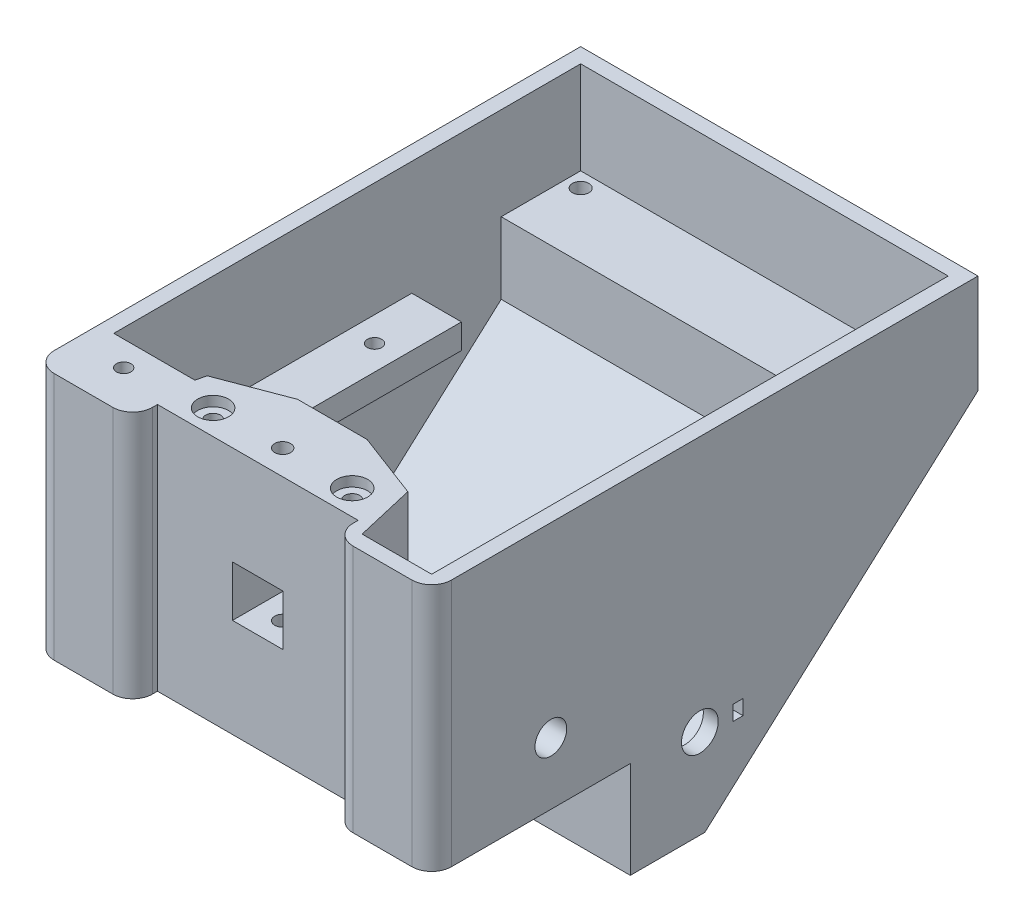
from build123d import *

# Parameters (mm, degrees)
BOSS_EXTRUDE1_DEPTH = 80
SHELL1_T            = -3
SKETCH3_W           = 46
SKETCH3_H           = 47
BOSS_EXTRUDE2_DEPTH = 17
SKETCH4_W           = 10.2
SKETCH4_H           = 10.2
CUT_EXTRUDE1_DEPTH  = 20
SKETCH6_W           = 15
SKETCH6_H           = 12.8
CUT_EXTRUDE2_DEPTH  = 3
SKETCH7_W           = 40.4
SKETCH7_H           = 50
CUT_EXTRUDE3_DEPTH  = 5
FILLET1_R           = 4
CUT_EXTRUDE7_DEPTH  = 47
SKETCH13_R          = 1.5
CUT_EXTRUDE8_DEPTH  = 25
SKETCH14_R          = 3.1
CUT_EXTRUDE9_DEPTH  = 2
SKETCH17_W          = 45
SKETCH17_H          = 5
BOSS_EXTRUDE5_DEPTH = 74
CUT_EXTRUDE10_REACH = 126.093
SKETCH18_W          = 54
SKETCH18_H          = 45
CUT_EXTRUDE11_REACH = 126.093
SKETCH19_R          = 1.45
BOSS_EXTRUDE6_DEPTH = 47
SKETCH22_R          = 1.45
CUT_EXTRUDE12_DEPTH = 135.415364765
CUT_EXTRUDE13_REACH = 126.857
SKETCH24_R          = 3.7
SKETCH24_W          = 2
SKETCH24_H          = 3
BOSS_EXTRUDE7_DEPTH = 74
SKETCH27_R          = 1.65
CUT_EXTRUDE14_DEPTH = 10
CUT_EXTRUDE15_START = -3
CUT_EXTRUDE15_DEPTH = 32
CUT_EXTRUDE16_DEPTH = 30
BOSS_EXTRUDE8_DEPTH = 20
SKETCH31_R          = 1.5
CUT_EXTRUDE17_DEPTH = 123.649786567
CUT_EXTRUDE18_DEPTH = 15
CUT_EXTRUDE19_REACH = 126.093
SKETCH33_W          = 10
SKETCH33_H          = 5
SKETCH34_R          = 1.6
CUT_EXTRUDE20_DEPTH = 135.415364765
CUT_EXTRUDE22_DEPTH = 14
CUT_EXTRUDE23_REACH = 126.857
SKETCH37_R          = 3.2
SKETCH38_W          = 10
SKETCH38_H          = 18.980735551
SKETCH38_R          = 3.2
BOSS_EXTRUDE9_DEPTH = 3
CUT_EXTRUDE24_REACH = 124.956
SKETCH40_R          = 3.7
SKETCH40_W          = 2
SKETCH40_H          = 3


with BuildPart() as part:
    # Sketch2 → Boss-Extrude1 (new body)
    with BuildSketch(Plane(origin=(0, 0, 0), x_dir=(0, 0, -1), z_dir=(1, 0, 0))):
        Polygon((-27.320490368, 20.998248687), (-27.320490368, -29.001751313), (12.679509632, -29.001751313), (12.679509632, -48.511383538), (27.679509632, -48.511383538), (82.679509632, 0.998248687), (82.679509632, 20.998248687), align=None)
    extrude(amount=BOSS_EXTRUDE1_DEPTH)

    # Shell1
    shell1_openings = [part.faces().sort_by_distance(p)[0] for p in [
        (40, 20.998248687, -27.679509632),
    ]]
    offset(amount=SHELL1_T, openings=shell1_openings, kind=Kind.INTERSECTION)

    # Sketch3 → Boss-Extrude2 (add)
    with BuildSketch(Plane(origin=(0, 0, 24.320490368), x_dir=(-1, 0, 0), z_dir=(0, 0, -1))):
        with Locations((-40, -2.501751313)):
            Rectangle(SKETCH3_W, SKETCH3_H)
    extrude(amount=BOSS_EXTRUDE2_DEPTH)

    # Sketch4 → Cut-Extrude1 (cut)
    with BuildSketch(Plane.XY.offset(27.320490368)):
        with Locations((40, -4.001751313)):
            Rectangle(SKETCH4_W, SKETCH4_H)
    extrude(amount=-CUT_EXTRUDE1_DEPTH, mode=Mode.SUBTRACT)

    # Sketch6 → Cut-Extrude2 (cut)
    with BuildSketch(Plane.XZ.offset(29.001751313)):
        with Locations((40, 0.920490368)):
            Rectangle(SKETCH6_W, SKETCH6_H)
    extrude(amount=-CUT_EXTRUDE2_DEPTH, mode=Mode.SUBTRACT)

    # Sketch7 → Cut-Extrude3 (cut)
    with BuildSketch(Plane.XY.offset(27.320490368)):
        with Locations((40, -4.001751313)):
            Rectangle(SKETCH7_W, SKETCH7_H)
    extrude(amount=-CUT_EXTRUDE3_DEPTH, mode=Mode.SUBTRACT)

    # Fillet1
    fillet1_edges = [part.edges().sort_by_distance(p)[0] for p in [
        (80, -4.001751313, 27.320490368),
        (19.8, -4.001751313, 27.320490368),
        (0, -4.001751313, 27.320490368),
        (60.2, -4.001751313, 27.320490368),
    ]]
    fillet(fillet1_edges, radius=FILLET1_R)

    # Sketch12 → Cut-Extrude7 (cut)
    with BuildSketch(Plane(origin=(0, 20.998248687, 0), x_dir=(1, 0, 0), z_dir=(0, 1, 0))):
        Polygon((33, -7.320490368), (19.8, -12.320490368), (17, -24.320490368), (17, -7.320490368), align=None)
        Polygon((47, -7.320490368), (63, -7.320490368), (63, -24.320490368), (60.2, -12.320490368), align=None)
    extrude(amount=-CUT_EXTRUDE7_DEPTH, mode=Mode.SUBTRACT)

    # Sketch13 → Cut-Extrude8 (cut)
    with BuildSketch(Plane(origin=(0, 20.998248687, 0), x_dir=(1, 0, 0), z_dir=(0, 1, 0))):
        with Locations(Location((26, -17.320490368, 0), (0, 0, 270))):
            Circle(SKETCH13_R)
        with Locations(Location((54, -17.320490368, 0), (0, 0, 270))):
            Circle(SKETCH13_R)
    extrude(amount=-CUT_EXTRUDE8_DEPTH, mode=Mode.SUBTRACT)

    # Sketch14 → Cut-Extrude9 (cut)
    with BuildSketch(Plane(origin=(0, 20.998248687, 0), x_dir=(1, 0, 0), z_dir=(0, 1, 0))):
        with Locations(Location((26, -17.320490368, 0), (0, 0, 270))):
            Circle(SKETCH14_R)
        with Locations(Location((54, -17.320490368, 0), (0, 0, 270))):
            Circle(SKETCH14_R)
    extrude(amount=-CUT_EXTRUDE9_DEPTH, mode=Mode.SUBTRACT)

    # Sketch17 → Boss-Extrude5 (add)
    with BuildSketch(Plane.ZY.offset(-77)):
        with Locations((-23.179509632, -4.501751313)):
            Rectangle(SKETCH17_W, SKETCH17_H)
    extrude(amount=BOSS_EXTRUDE5_DEPTH)

    # Sketch18 → Cut-Extrude10 (cut, up to next)
    with BuildSketch(Plane(origin=(0, -2.001751313, 0), x_dir=(1, 0, 0), z_dir=(0, 1, 0)), mode=Mode.PRIVATE) as cut_extrude10_sk1:
        with Locations((40, 23.179509632)):
            Rectangle(SKETCH18_W, SKETCH18_H)
    cut_extrude10_tool1 = extrude(cut_extrude10_sk1.sketch, amount=-CUT_EXTRUDE10_REACH, mode=Mode.PRIVATE) & part.part
    add(cut_extrude10_tool1.solids().sort_by_distance((40, -2.001751, -23.17951))[0], mode=Mode.SUBTRACT)

    # Sketch19 → Cut-Extrude11 (cut, up to next)
    with BuildSketch(Plane(origin=(0, -2.001751313, 0), x_dir=(1, 0, 0), z_dir=(0, 1, 0)), mode=Mode.PRIVATE) as cut_extrude11_sk1:
        with Locations(Location((72, 37.179509632, 0), (0, 0, 270))):
            Circle(SKETCH19_R)
    cut_extrude11_tool1 = extrude(cut_extrude11_sk1.sketch, amount=-CUT_EXTRUDE11_REACH, mode=Mode.PRIVATE) & part.part
    # Sketch19 → Cut-Extrude11 (cut, up to next)
    with BuildSketch(Plane(origin=(0, -2.001751313, 0), x_dir=(1, 0, 0), z_dir=(0, 1, 0)), mode=Mode.PRIVATE) as cut_extrude11_sk2:
        with Locations(Location((72, 6.179509632, 0), (0, 0, 270))):
            Circle(SKETCH19_R)
    cut_extrude11_tool2 = extrude(cut_extrude11_sk2.sketch, amount=-CUT_EXTRUDE11_REACH, mode=Mode.PRIVATE) & part.part
    # Sketch19 → Cut-Extrude11 (cut, up to next)
    with BuildSketch(Plane(origin=(0, -2.001751313, 0), x_dir=(1, 0, 0), z_dir=(0, 1, 0)), mode=Mode.PRIVATE) as cut_extrude11_sk3:
        with Locations(Location((8, 33.179509632, 0), (0, 0, 270))):
            Circle(SKETCH19_R)
    cut_extrude11_tool3 = extrude(cut_extrude11_sk3.sketch, amount=-CUT_EXTRUDE11_REACH, mode=Mode.PRIVATE) & part.part
    # Sketch19 → Cut-Extrude11 (cut, up to next)
    with BuildSketch(Plane(origin=(0, -2.001751313, 0), x_dir=(1, 0, 0), z_dir=(0, 1, 0)), mode=Mode.PRIVATE) as cut_extrude11_sk4:
        with Locations(Location((8, 6.179509632, 0), (0, 0, 270))):
            Circle(SKETCH19_R)
    cut_extrude11_tool4 = extrude(cut_extrude11_sk4.sketch, amount=-CUT_EXTRUDE11_REACH, mode=Mode.PRIVATE) & part.part
    add(cut_extrude11_tool1.solids().sort_by_distance((72, -2.001751, -37.17951))[0], mode=Mode.SUBTRACT)
    add(cut_extrude11_tool2.solids().sort_by_distance((72, -2.001751, -6.17951))[0], mode=Mode.SUBTRACT)
    add(cut_extrude11_tool3.solids().sort_by_distance((8, -2.001751, -33.17951))[0], mode=Mode.SUBTRACT)
    add(cut_extrude11_tool4.solids().sort_by_distance((8, -2.001751, -6.17951))[0], mode=Mode.SUBTRACT)

    # Sketch21 → Boss-Extrude6 (add)
    with BuildSketch(Plane(origin=(0, -26.001751313, 0), x_dir=(1, 0, 0), z_dir=(0, 1, 0))):
        Polygon((3, -24.320490368), (3, -14.320490368), (19.333333333, -14.320490368), (17, -24.320490368), align=None)
    extrude(amount=BOSS_EXTRUDE6_DEPTH)

    # Sketch22 → Cut-Extrude12 (cut, through all)
    with BuildSketch(Plane(origin=(0, 20.998248687, 0), x_dir=(1, 0, 0), z_dir=(0, 1, 0))):
        with Locations(Location((10, -19.320490368, 0), (0, 0, 270))):
            Circle(SKETCH22_R)
    extrude(amount=-CUT_EXTRUDE12_DEPTH, mode=Mode.SUBTRACT)

    # Sketch24 → Cut-Extrude13 (cut, up to next)
    with BuildSketch(Plane(origin=(80, 0, 0), x_dir=(0, 0, -1), z_dir=(1, 0, 0)), mode=Mode.PRIVATE) as cut_extrude13_sk1:
        with Locations((26.679509632, -30.511383538)):
            Circle(SKETCH24_R)
    cut_extrude13_tool1 = extrude(cut_extrude13_sk1.sketch, amount=-CUT_EXTRUDE13_REACH, mode=Mode.PRIVATE) & part.part
    # Sketch24 → Cut-Extrude13 (cut, up to next)
    with BuildSketch(Plane(origin=(80, 0, 0), x_dir=(0, 0, -1), z_dir=(1, 0, 0)), mode=Mode.PRIVATE) as cut_extrude13_sk2:
        with Locations((34.379509632, -30.511383538)):
            Rectangle(SKETCH24_W, SKETCH24_H)
    cut_extrude13_tool2 = extrude(cut_extrude13_sk2.sketch, amount=-CUT_EXTRUDE13_REACH, mode=Mode.PRIVATE) & part.part
    add(cut_extrude13_tool1.solids().sort_by_distance((80, -30.511384, -26.67951))[0], mode=Mode.SUBTRACT)
    add(cut_extrude13_tool2.solids().sort_by_distance((80, -30.511384, -34.37951))[0], mode=Mode.SUBTRACT)

    # Sketch26 → Boss-Extrude7 (add)
    with BuildSketch(Plane(origin=(3, 0, 0), x_dir=(0, 0, -1), z_dir=(1, 0, 0))):
        Polygon((79.679509632, 2.334161996), (63.679509632, 2.334161996), (63.679509632, -12.068640106), align=None)
    extrude(amount=BOSS_EXTRUDE7_DEPTH)

    # Sketch27 → Cut-Extrude14 (cut)
    with BuildSketch(Plane(origin=(0, 2.334161996, 0), x_dir=(1, 0, 0), z_dir=(0, 1, 0))):
        with Locations(Location((6, 76.679509632, 0), (0, 0, 270))):
            Circle(SKETCH27_R)
        with Locations(Location((74, 76.679509632, 0), (0, 0, 270))):
            Circle(SKETCH27_R)
    extrude(amount=-CUT_EXTRUDE14_DEPTH, mode=Mode.SUBTRACT)

    # Sketch28 → Cut-Extrude15 (cut)
    with BuildSketch(Plane(origin=(0, 2.334161996, 0), x_dir=(1, 0, 0), z_dir=(0, 1, 0)).offset(CUT_EXTRUDE15_START)):
        Polygon((74, 79.929509632), (71.185417438, 78.304509632), (71.185417438, 75.054509632), (74, 73.429509632), (76.814582562, 75.054509632), (76.814582562, 78.304509632), align=None)
        Polygon((6, 73.429509632), (8.814582562, 75.054509632), (8.814582562, 78.304509632), (6, 79.929509632), (3.185417438, 78.304509632), (3.185417438, 75.054509632), align=None)
    extrude(amount=-CUT_EXTRUDE15_DEPTH, mode=Mode.SUBTRACT)

    # Sketch29 → Cut-Extrude16 (cut)
    with BuildSketch(Plane.XZ.offset(29.001751313)):
        Polygon((7.185417438, 17.695490368), (10, 16.070490368), (12.814582562, 17.695490368), (12.814582562, 20.945490368), (10, 22.570490368), (7.185417438, 20.945490368), align=None)
    extrude(amount=-CUT_EXTRUDE16_DEPTH, mode=Mode.SUBTRACT)

    # Sketch30 → Boss-Extrude8 (add)
    with BuildSketch(Plane(origin=(0, -26.001751313, 0), x_dir=(1, 0, 0), z_dir=(0, 1, 0))):
        Polygon((77, -24.320490368), (63, -24.320490368), (60.2, -12.320490368), (77, -12.320490368), align=None)
    extrude(amount=BOSS_EXTRUDE8_DEPTH)

    # Sketch31 → Cut-Extrude17 (cut, through all)
    with BuildSketch(Plane(origin=(0, -6.001751313, 0), x_dir=(1, 0, 0), z_dir=(0, 1, 0))):
        with Locations(Location((72, -21.320490368, 0), (0, 0, 270))):
            Circle(SKETCH31_R)
    extrude(amount=-CUT_EXTRUDE17_DEPTH, mode=Mode.SUBTRACT)

    # Sketch32 → Cut-Extrude18 (cut)
    with BuildSketch(Plane.XZ.offset(29.001751313)):
        Polygon((72, 24.570490368), (69.185417438, 22.945490368), (69.185417438, 19.695490368), (72, 18.070490368), (74.814582562, 19.695490368), (74.814582562, 22.945490368), align=None)
    extrude(amount=-CUT_EXTRUDE18_DEPTH, mode=Mode.SUBTRACT)

    # Sketch33 → Cut-Extrude19 (cut, up to next)
    with BuildSketch(Plane(origin=(0, -2.001751313, 0), x_dir=(1, 0, 0), z_dir=(0, 1, 0)), mode=Mode.PRIVATE) as cut_extrude19_sk1:
        with Locations((72, 43.179509632)):
            Rectangle(SKETCH33_W, SKETCH33_H)
    cut_extrude19_tool1 = extrude(cut_extrude19_sk1.sketch, amount=-CUT_EXTRUDE19_REACH, mode=Mode.PRIVATE) & part.part
    add(cut_extrude19_tool1.solids().sort_by_distance((72, -2.001751, -43.17951))[0], mode=Mode.SUBTRACT)

    # Sketch34 → Cut-Extrude20 (cut, through all)
    with BuildSketch(Plane(origin=(0, 20.998248687, 0), x_dir=(1, 0, 0), z_dir=(0, 1, 0))):
        with Locations(Location((40, -17.320490368, 0), (0, 0, 270))):
            Circle(SKETCH34_R)
    extrude(amount=-CUT_EXTRUDE20_DEPTH, mode=Mode.SUBTRACT)

    # Sketch36 → Cut-Extrude22 (cut)
    with BuildSketch(Plane.XZ.offset(29.001751313)):
        Polygon((38.375, 20.13507293), (36.75, 17.320490368), (38.375, 14.505907805), (41.625, 14.505907805), (43.25, 17.320490368), (41.625, 20.13507293), align=None)
    extrude(amount=-CUT_EXTRUDE22_DEPTH, mode=Mode.SUBTRACT)

    # Sketch37 → Cut-Extrude23 (cut, up to next)
    with BuildSketch(Plane(origin=(80, 0, 0), x_dir=(0, 0, -1), z_dir=(1, 0, 0)), mode=Mode.PRIVATE) as cut_extrude23_sk1:
        with Locations((-3.320490368, -16.511383538)):
            Circle(SKETCH37_R)
    cut_extrude23_tool1 = extrude(cut_extrude23_sk1.sketch, amount=-CUT_EXTRUDE23_REACH, mode=Mode.PRIVATE) & part.part
    add(cut_extrude23_tool1.solids().sort_by_distance((80, -16.511384, 3.32049))[0], mode=Mode.SUBTRACT)

    # Sketch38 → Boss-Extrude9 (add)
    with BuildSketch(Plane.ZY.offset(-77)):
        with Locations((3.320490368, -16.511383538)):
            Rectangle(SKETCH38_W, SKETCH38_H)
        with Locations(Location((3.320490368, -16.511383538, 0), (0, 0, 180))):
            Circle(SKETCH38_R, mode=Mode.SUBTRACT)
    extrude(amount=BOSS_EXTRUDE9_DEPTH)

    # Sketch40 → Cut-Extrude24 (cut, up to next)
    with BuildSketch(Plane(origin=(3, 0, 0), x_dir=(0, 0, -1), z_dir=(1, 0, 0)), mode=Mode.PRIVATE) as cut_extrude24_sk1:
        with Locations((26.679509632, -30.511383538)):
            Circle(SKETCH40_R)
    cut_extrude24_tool1 = extrude(cut_extrude24_sk1.sketch, amount=-CUT_EXTRUDE24_REACH, mode=Mode.PRIVATE) & part.part
    # Sketch40 → Cut-Extrude24 (cut, up to next)
    with BuildSketch(Plane(origin=(3, 0, 0), x_dir=(0, 0, -1), z_dir=(1, 0, 0)), mode=Mode.PRIVATE) as cut_extrude24_sk2:
        with Locations((18.979509632, -30.511383538)):
            Rectangle(SKETCH40_W, SKETCH40_H)
    cut_extrude24_tool2 = extrude(cut_extrude24_sk2.sketch, amount=-CUT_EXTRUDE24_REACH, mode=Mode.PRIVATE) & part.part
    add(cut_extrude24_tool1.solids().sort_by_distance((3, -30.511384, -26.67951))[0], mode=Mode.SUBTRACT)
    add(cut_extrude24_tool2.solids().sort_by_distance((3, -30.511384, -18.97951))[0], mode=Mode.SUBTRACT)


solid = part.part
